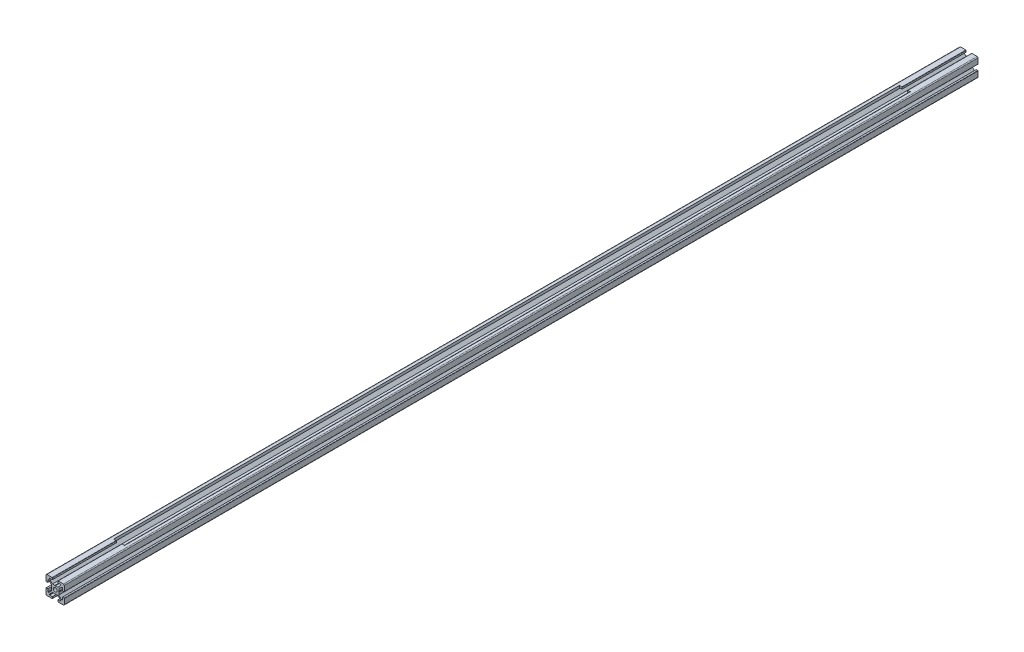
from build123d import *

# Parameters (mm, degrees)
SKETCH1_R           = 2.1
BOSS_EXTRUDE1_DEPTH = 500
SKETCH2_W           = 12
SKETCH2_H           = 2
CUT_EXTRUDE1_DEPTH  = 430


with BuildPart() as part:
    # Sketch1 → Boss-Extrude1 (new, symmetric)
    with BuildSketch(Plane(origin=(0, 0, 0), x_dir=(-1, 0, 0), z_dir=(0, 0, -1))):
        with BuildLine():
            Line((10, 3.3), (10, 9))
            ThreePointArc((10, 9), (9.707106781, 9.707106781), (9, 10))
            Line((9, 10), (3.3, 10))
            ThreePointArc((3.3, 10), (3.087867966, 9.912132034), (3, 9.7))
            Line((3, 9.7), (3, 8))
            Line((3, 8), (6, 8))
            Line((6, 8), (6, 7.060660172))
            Line((6, 7.060660172), (2.939339828, 4))
            Line((2.939339828, 4), (0.3, 4))
            Line((0.3, 4), (0, 3.7))
            Line((0, 3.7), (-0.3, 4))
            Line((-0.3, 4), (-2.939339828, 4))
            Line((-2.939339828, 4), (-6, 7.060660172))
            Line((-6, 7.060660172), (-6, 8))
            Line((-6, 8), (-3, 8))
            Line((-3, 8), (-3, 9.7))
            ThreePointArc((-3, 9.7), (-3.087867966, 9.912132034), (-3.3, 10))
            Line((-3.3, 10), (-9, 10))
            ThreePointArc((-9, 10), (-9.707106781, 9.707106781), (-10, 9))
            Line((-10, 9), (-10, 3.3))
            ThreePointArc((-10, 3.3), (-9.912132034, 3.087867966), (-9.7, 3))
            Line((-9.7, 3), (-8, 3))
            Line((-8, 3), (-8, 6))
            Line((-8, 6), (-7.060660172, 6))
            Line((-7.060660172, 6), (-4, 2.939339828))
            Line((-4, 2.939339828), (-4, 0.3))
            Line((-4, 0.3), (-3.7, 0))
            Line((-3.7, 0), (-4, -0.3))
            Line((-4, -0.3), (-4, -2.939339828))
            Line((-4, -2.939339828), (-7.060660172, -6))
            Line((-7.060660172, -6), (-8, -6))
            Line((-8, -6), (-8, -3))
            Line((-8, -3), (-9.7, -3))
            ThreePointArc((-9.7, -3), (-9.912132034, -3.087867966), (-10, -3.3))
            Line((-10, -3.3), (-10, -9))
            ThreePointArc((-10, -9), (-9.707106781, -9.707106781), (-9, -10))
            Line((-9, -10), (-3.3, -10))
            ThreePointArc((-3.3, -10), (-3.087867966, -9.912132034), (-3, -9.7))
            Line((-3, -9.7), (-3, -8))
            Line((-3, -8), (-6, -8))
            Line((-6, -8), (-6, -7.060660172))
            Line((-6, -7.060660172), (-2.939339828, -4))
            Line((-2.939339828, -4), (-0.3, -4))
            Line((-0.3, -4), (0, -3.7))
            Line((0, -3.7), (0.3, -4))
            Line((0.3, -4), (2.939339828, -4))
            Line((2.939339828, -4), (6, -7.060660172))
            Line((6, -7.060660172), (6, -8))
            Line((6, -8), (3, -8))
            Line((3, -8), (3, -9.7))
            ThreePointArc((3, -9.7), (3.087867966, -9.912132034), (3.3, -10))
            Line((3.3, -10), (9, -10))
            ThreePointArc((9, -10), (9.707106781, -9.707106781), (10, -9))
            Line((10, -9), (10, -3.3))
            ThreePointArc((10, -3.3), (9.912132034, -3.087867966), (9.7, -3))
            Line((9.7, -3), (8, -3))
            Line((8, -3), (8, -6))
            Line((8, -6), (7.060660172, -6))
            Line((7.060660172, -6), (4, -2.939339828))
            Line((4, -2.939339828), (4, -0.3))
            Line((4, -0.3), (3.7, 0))
            Line((3.7, 0), (4, 0.3))
            Line((4, 0.3), (4, 2.939339828))
            Line((4, 2.939339828), (7.060660172, 6))
            Line((7.060660172, 6), (8, 6))
            Line((8, 6), (8, 3))
            Line((8, 3), (9.7, 3))
            ThreePointArc((9.7, 3), (9.912132034, 3.087867966), (10, 3.3))
        make_face()
        with Locations(Location((0, 0, 0), (0, 0, 180))):
            Circle(SKETCH1_R, mode=Mode.SUBTRACT)
    extrude(amount=BOSS_EXTRUDE1_DEPTH, both=True)

    # Sketch2 → Cut-Extrude1 (cut, symmetric)
    with BuildSketch(Plane.XY):
        with Locations((0, 9)):
            Rectangle(SKETCH2_W, SKETCH2_H)
    cut_extrude1 = extrude(amount=CUT_EXTRUDE1_DEPTH, both=True, mode=Mode.SUBTRACT)

    # Mirror1: Cut-Extrude1 across plane
    add(cut_extrude1.mirror(Plane.ZX), mode=Mode.SUBTRACT)


solid = part.part
